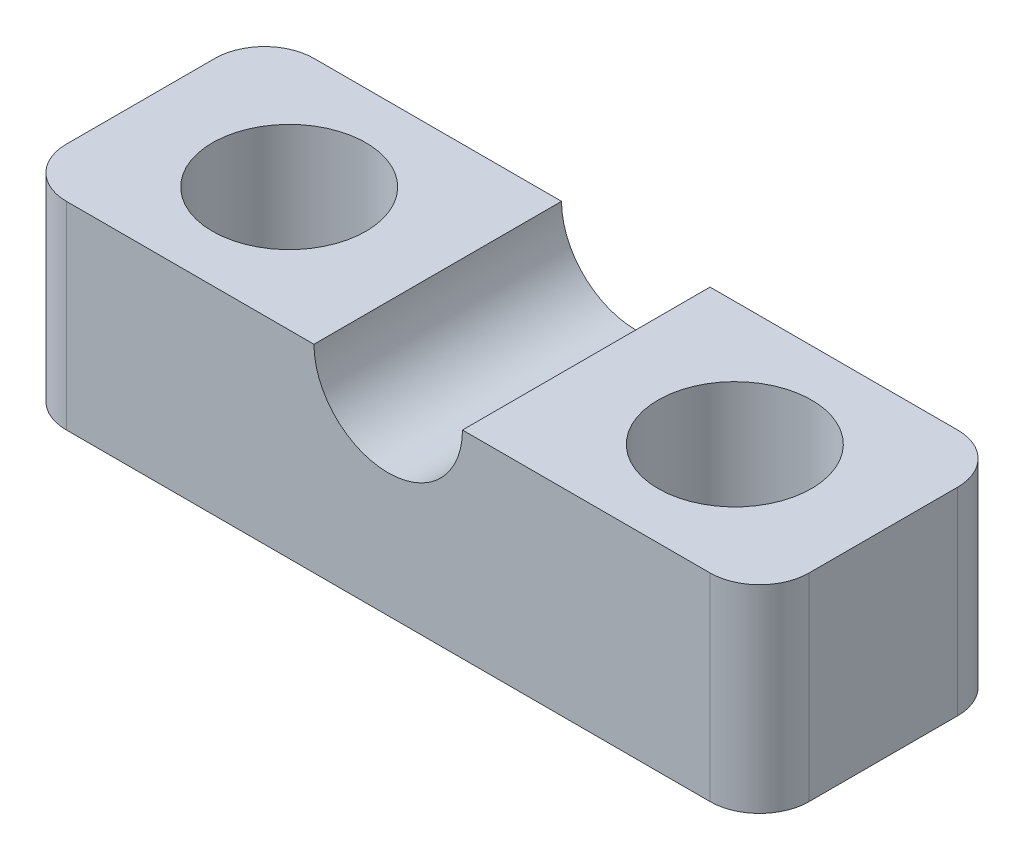
from build123d import *

# Parameters (mm, degrees)
SKETCH1_W               = 15
SKETCH1_H               = 5
BOSS_EXTRUDE1_DEPTH     = 4
CUT_EXTRUDE1_DEPTH      = 13.172355436
CUT_EXTRUDE1_DEPTH_BACK = 13.172355436
SKETCH2_R               = 1.5
SKETCH3_R               = 1.55
CUT_EXTRUDE2_DEPTH      = 12.4586554
FILLET1_R               = 1


with BuildPart() as part:
    # Sketch1 → Boss-Extrude1 (new body)
    with BuildSketch(Plane(origin=(0, 0, 0), x_dir=(1, 0, 0), z_dir=(0, 1, 0))):
        with Locations((2.852112676, 0.352112676)):
            Rectangle(SKETCH1_W, SKETCH1_H)
    extrude(amount=BOSS_EXTRUDE1_DEPTH)

    # Sketch2 → Cut-Extrude1 (cut, two sides: drawn at the far end of the back side and taken through both)
    with BuildSketch(Plane(origin=(0, 0, -2.852112676), x_dir=(-1, 0, 0), z_dir=(0, 0, -1)).offset(-CUT_EXTRUDE1_DEPTH_BACK)):
        with Locations((-2.852112676, 4)):
            Circle(SKETCH2_R)
    extrude(amount=CUT_EXTRUDE1_DEPTH + CUT_EXTRUDE1_DEPTH_BACK, mode=Mode.SUBTRACT)

    # Sketch3 → Cut-Extrude2 (cut, through all)
    with BuildSketch(Plane(origin=(0, 4, 0), x_dir=(1, 0, 0), z_dir=(0, 1, 0))):
        with Locations(Location((-1.647887324, 0.352112676, 0), (0, 0, 270))):
            Circle(SKETCH3_R)
        with Locations(Location((7.352112676, 0.352112676, 0), (0, 0, 270))):
            Circle(SKETCH3_R)
    extrude(amount=-CUT_EXTRUDE2_DEPTH, mode=Mode.SUBTRACT)

    # Fillet1
    fillet1_edges = [part.edges().sort_by_distance(p)[0] for p in [
        (-4.647887324, 2, -2.852112676),
        (10.352112676, 2, -2.852112676),
        (10.352112676, 2, 2.147887324),
        (-4.647887324, 2, 2.147887324),
    ]]
    fillet(fillet1_edges, radius=FILLET1_R)


solid = part.part
